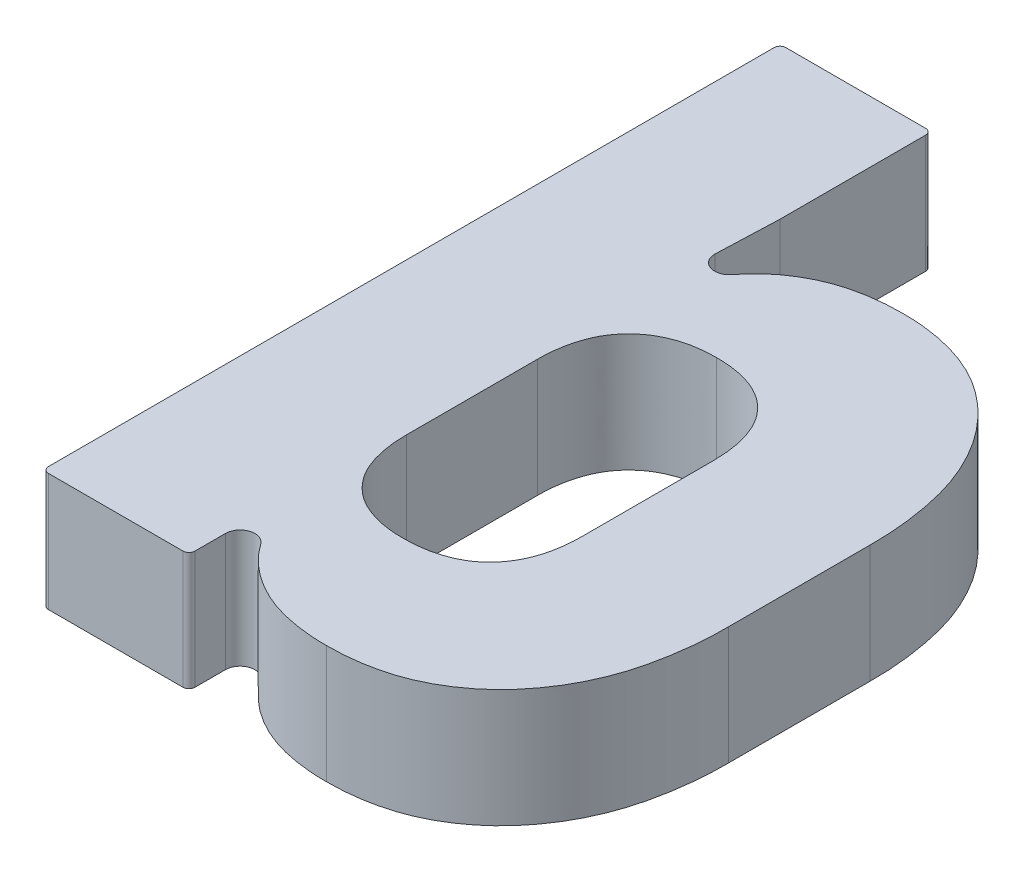
from build123d import *

# Parameters (mm, degrees)
BOSS_EXTRUDE1_DEPTH = 20
FILLET1_R           = 2.5
FILLET2_R           = 1


with BuildPart() as part:
    # Sketch1 → Boss-Extrude1 (new body)
    with BuildSketch(Plane(origin=(0, 0, 0), x_dir=(1, 0, 0), z_dir=(0, 1, 0))):
        with BuildLine():
            Line((36.117717004, 19.916765755), (36.117717004, 0))
            Line((36.117717004, 0), (11.2960761, 0))
            Line((11.2960761, 0), (11.2960761, 125))
            Line((11.2960761, 125), (36.984740388, 125))
            Line((36.984740388, 125), (36.984740388, 99.311335711))
            Line((36.984740388, 99.311335711), (36.117717004, 76.198969481))
            add(Edge.make_bspline(
                [(36.117717004, 76.198969481), (37.079035526, 78.513840699), (37.821716785, 81.825002834), (39.841285118, 85.425058127), (41.21525815, 87.372030125), (42.770642161, 89.163856041), (44.531204538, 90.74523712), (46.455711817, 92.116095649), (48.524028366, 93.283848821), (50.743017021, 94.262315505), (53.129690053, 95.000321934), (56.595091524, 95.697992737), (59.296350256, 95.909848431), (61.137534681, 95.892786365)],
                knots=[0, 0, 0, 0, 0.21768002, 0.286847597, 0.354813327, 0.422943008, 0.491013117, 0.558398108, 0.626322787, 0.695519685, 0.767143763, 0.841303709, 1, 1, 1, 1], degree=3))
            add(Edge.make_bspline(
                [(61.137534681, 95.892786365), (63.395086057, 95.903685841), (66.735821106, 95.621334637), (70.981289729, 94.544167423), (73.935977914, 93.451744493), (76.70594677, 92.030063316), (79.28991441, 90.280281683), (81.71457152, 88.236417621), (83.926657745, 85.882399021), (85.942182726, 83.286794391), (87.670170765, 80.442277233), (89.170620742, 77.406405656), (90.390921152, 74.14710145), (91.289056083, 70.663202505), (92.199939451, 65.644798855), (92.480055787, 61.741506128), (92.449464923, 59.081450654)],
                knots=[0, 0, 0, 0, 0.12448834, 0.183662525, 0.240987058, 0.297785083, 0.354848785, 0.412664579, 0.472231373, 0.532594602, 0.593487538, 0.655372754, 0.719036994, 0.784951013, 0.85343042, 1, 1, 1, 1], degree=3))
            Line((92.449464923, 59.081450654), (92.449464923, 35.102061038))
            add(Edge.make_bspline(
                [(92.449464923, 35.102061038), (92.481706946, 32.417206566), (92.200218527, 28.481210749), (91.291825145, 23.429095843), (90.392084489, 19.936614782), (89.162904767, 16.673762861), (87.685043138, 13.625497661), (85.932163927, 10.795769529), (83.93534446, 8.202568905), (81.712640064, 5.873123122), (79.290226272, 3.851331714), (76.698739641, 2.131042563), (73.936325888, 0.70776156), (70.984961829, -0.392480025), (66.728426656, -1.4160417), (63.397954668, -1.731864559), (61.137534681, -1.709274673)],
                knots=[0, 0, 0, 0, 0.147807026, 0.216676018, 0.282534324, 0.346144753, 0.408386101, 0.468840468, 0.529152677, 0.588339784, 0.645814146, 0.702576919, 0.759326937, 0.816603017, 0.875616881, 1, 1, 1, 1], degree=3))
            add(Edge.make_bspline(
                [(61.137534681, -1.709274673), (59.296350246, -1.726336751), (56.595091542, -1.514481022), (53.129690028, -0.816810273), (50.743017111, -0.078803702), (48.524028045, 0.899662475), (46.455712988, 2.067417488), (44.531200185, 3.438269202), (42.7706586, 5.019675936), (41.215196821, 6.811405891), (39.841515083, 8.758737328), (38.654148229, 10.871953586), (37.24125462, 14.565590682), (36.509346228, 17.63130127), (36.117717004, 19.916765755)],
                knots=[0, 0, 0, 0, 0.150649959, 0.221049795, 0.289042338, 0.354730766, 0.41921148, 0.483179869, 0.547798639, 0.612473961, 0.676993644, 0.742654238, 0.810316636, 1, 1, 1, 1], degree=3))
        make_face()
        with BuildLine():
            Line((66.785572731, 35.969084423), (66.785572731, 58.214427269))
            add(Edge.make_bspline(
                [(66.785572731, 58.214427269), (66.771829802, 60.406770749), (66.417836342, 63.625724633), (64.723817468, 67.39558891), (63.000354868, 69.655005362), (60.827701936, 71.453642984), (57.173659281, 73.229809674), (54.023085733, 73.637658685), (51.872770511, 73.622671423)],
                knots=[0, 0, 0, 0, 0.271016724, 0.390594505, 0.504399399, 0.61771336, 0.734495657, 1, 1, 1, 1], degree=3))
            add(Edge.make_bspline(
                [(51.872770511, 73.622671423), (49.759720525, 73.644159543), (46.659201079, 73.209984567), (43.036444514, 71.44905498), (40.849183836, 69.648312437), (39.063540587, 67.412914524), (37.394409246, 63.61564329), (36.967690872, 60.41840948), (36.984740388, 58.214427269)],
                knots=[0, 0, 0, 0, 0.261213344, 0.378316389, 0.492729113, 0.608095085, 0.728001293, 1, 1, 1, 1], degree=3))
            Line((36.984740388, 58.214427269), (36.984740388, 35.969084423))
            add(Edge.make_bspline(
                [(36.984740388, 35.969084423), (36.967648998, 33.758379722), (37.387401392, 30.548144965), (39.070893069, 26.743120106), (40.841102205, 24.488680021), (43.031159697, 22.68091473), (46.671799289, 20.967376381), (49.754651115, 20.503707396), (51.872770511, 20.536068173)],
                knots=[0, 0, 0, 0, 0.272641397, 0.39238352, 0.508393071, 0.622649228, 0.739144111, 1, 1, 1, 1], degree=3))
            add(Edge.make_bspline(
                [(51.872770511, 20.536068173), (54.028327267, 20.509831436), (57.160874782, 20.947979289), (60.832954812, 22.676374312), (63.008458872, 24.482146365), (64.716399441, 26.760301899), (66.424893748, 30.538107854), (66.771576456, 33.77007391), (66.785572731, 35.969084423)],
                knots=[0, 0, 0, 0, 0.265139708, 0.381314935, 0.494473274, 0.608929805, 0.728343363, 1, 1, 1, 1], degree=3))
        make_face(mode=Mode.SUBTRACT)
    extrude(amount=-BOSS_EXTRUDE1_DEPTH)

    # Fillet1
    fillet1_edges = [part.edges().sort_by_distance(p)[0] for p in [
        (36.117717004, -10, -76.198969481),
        (36.117717004, -10, -19.916765755),
    ]]
    fillet(fillet1_edges, radius=FILLET1_R)

    # Fillet2
    fillet2_edges = [part.edges().sort_by_distance(p)[0] for p in [
        (36.117717004, -10, 0),
        (11.2960761, -10, 0),
        (11.2960761, -10, -125),
        (36.984740388, -10, -125),
    ]]
    fillet(fillet2_edges, radius=FILLET2_R)


solid = part.part
